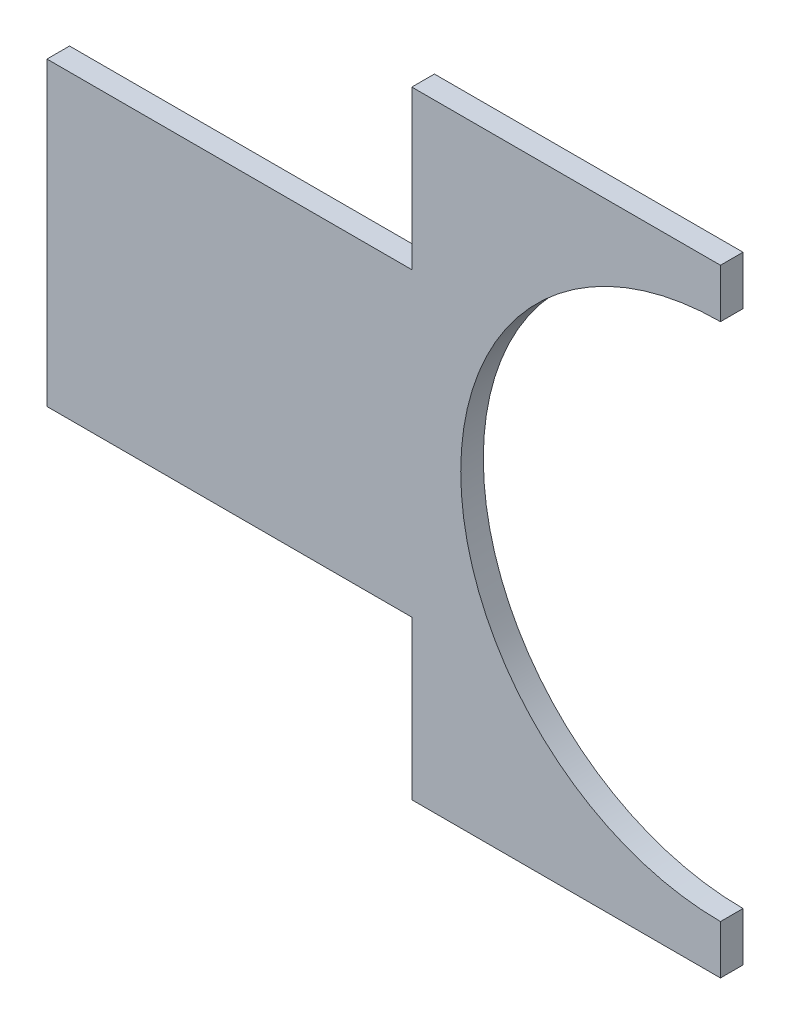
from build123d import *

# Parameters (mm, degrees)
SKETCH_1_W      = 110
SKETCH_1_H      = 80
EXTRUDE_1_DEPTH = 6
EXTRUDE_2_DEPTH = 6


with BuildPart() as part:
    # Эскиз1 → Бобышка-Вытянуть1 (new body)
    with BuildSketch(Plane.XY):
        Rectangle(SKETCH_1_W, SKETCH_1_H)
    extrude(amount=EXTRUDE_1_DEPTH)

    # Эскиз2 → Бобышка-Вытянуть2 (add)
    with BuildSketch(Plane.XY.offset(6)):
        with BuildLine():
            Line((124.05, 82.05), (42, 82.05))
            Line((42, 82.05), (42, -82.05))
            Line((42, -82.05), (124.05, -82.05))
            Line((124.05, -82.05), (124.05, -69.05))
            ThreePointArc((124.05, -69.05), (55, 0), (124.05, 69.05))
            Line((124.05, 69.05), (124.05, 82.05))
        make_face()
    extrude(amount=-EXTRUDE_2_DEPTH)


solid = part.part
